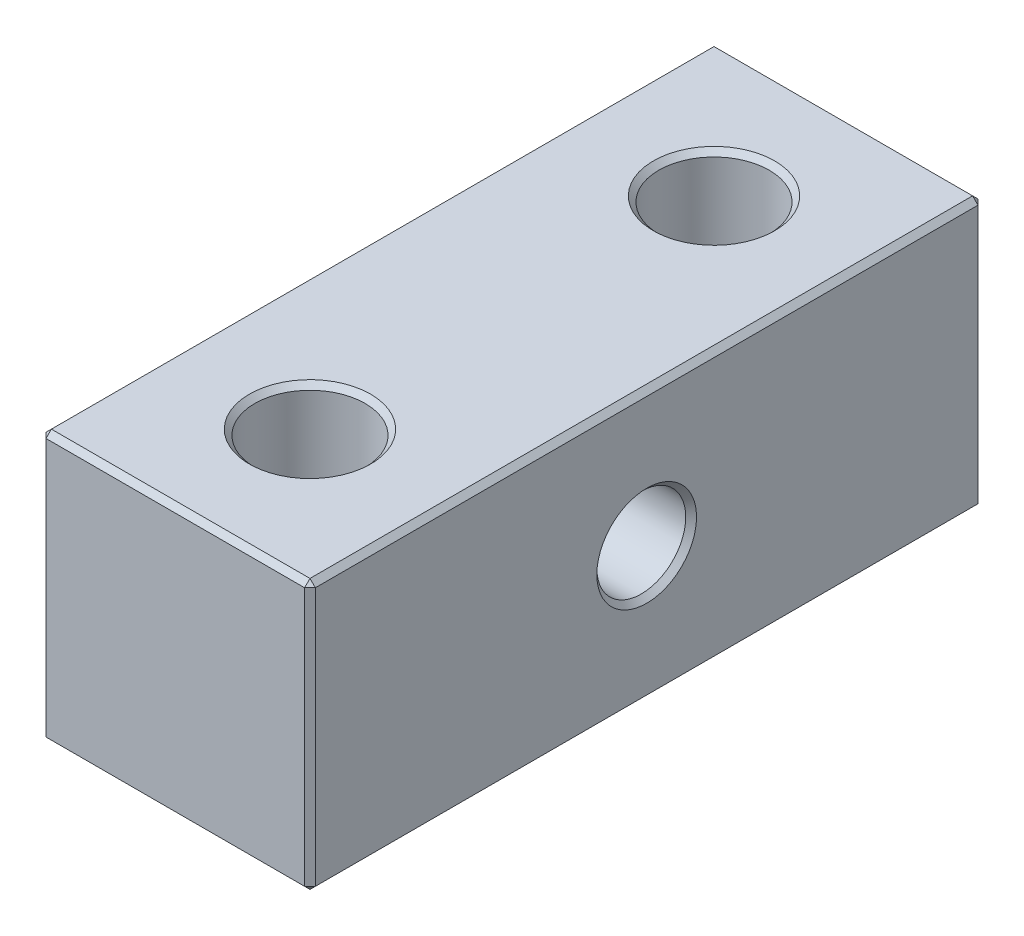
from build123d import *

# Parameters (mm, degrees)
SKETCH_1_W              = 10
SKETCH_1_H              = 10
EXTRUDE_1_DEPTH         = 12.5
HOLE_WIZARD_M4_1_D      = 3.3
HOLE_WIZARD_4_1_4_1_1_D = 4.1
CHAMFER_1_SIZE          = 0.2


with BuildPart() as part:
    # 草图1 → 凸台-拉伸1 (new, symmetric)
    with BuildSketch(Plane.XY):
        Rectangle(SKETCH_1_W, SKETCH_1_H)
    extrude(amount=EXTRUDE_1_DEPTH, both=True)

    # M4 螺纹孔1 (through all)
    with Locations(Plane(origin=(5, 0, 0), x_dir=(0, 0, -1), z_dir=(1, 0, 0))):
        with Locations((0, 0)):
            Hole(HOLE_WIZARD_M4_1_D / 2)

    # Ø4.1 (4.1) 直径孔1 (through all)
    with Locations(Plane(origin=(0, 5, 0), x_dir=(1, 0, 0), z_dir=(0, 1, 0))):
        with Locations((0, -7.5), (0, 7.5)):
            Hole(HOLE_WIZARD_4_1_4_1_1_D / 2)

    # 倒角1
    chamfer_1_edges = [part.edges().sort_by_distance(p)[0] for p in [
        (-5, 0, 12.5),
        (5, 0, -1.65),
        (-5, 0, -1.65),
        (0, -5, 12.5),
        (2.05, 5, -7.5),
        (2.05, -5, -7.5),
        (2.05, 5, 7.5),
        (2.05, -5, 7.5),
        (5, 0, 12.5),
        (0, -5, -12.5),
        (-5, 0, -12.5),
        (0, 5, -12.5),
        (5, 0, -12.5),
        (5, -5, 0),
        (-5, -5, 0),
        (-5, 5, 0),
        (5, 5, 0),
        (0, 5, 12.5),
    ]]
    chamfer(chamfer_1_edges, length=CHAMFER_1_SIZE)


solid = part.part
